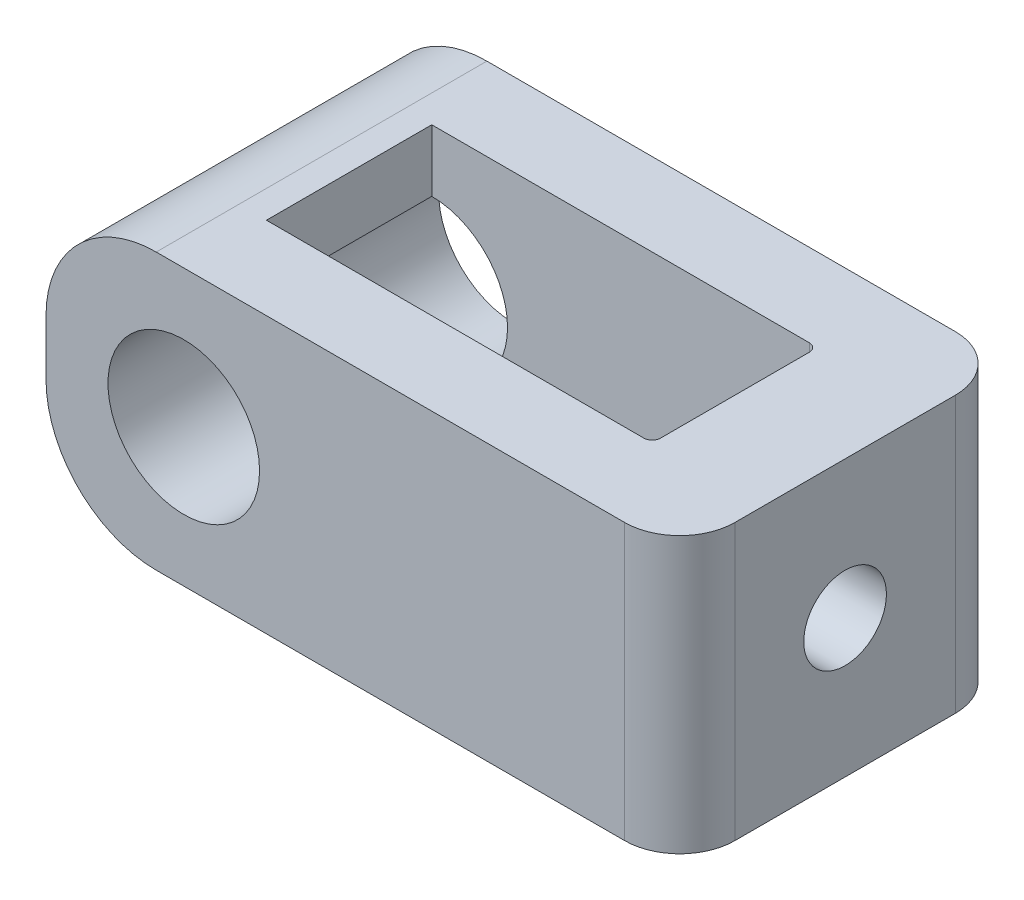
from build123d import *
from build123d.topology import SkipClean

# Parameters (mm, degrees)
EXTRUDE_1_DEPTH     = 10
SKETCH_2_R          = 2.75
CUT_EXTRUDE_1_DEPTH = 16
FILLET_1_R          = 4
SKETCH_3_R          = 1.5
CUT_EXTRUDE_2_DEPTH = 10
FILLET_2_R          = 2
FILLET_3_R          = 0.3
EXTRUDE_4_DEPTH     = 6


with BuildPart() as part:
    # 草图1 → 凸台-拉伸1 (new body)
    with BuildSketch(Plane(origin=(0, 0, 0), x_dir=(1, 0, 0), z_dir=(0, 1, 0))):
        Polygon((0, 3), (-19, 3), (-19, 6), (0, 6), (4, 6), (4, -6), (0, -6), (-19, -6), (-19, -3), (0, -3), align=None)
    extrude(amount=EXTRUDE_1_DEPTH)

    # 草图2 → 切除-拉伸1 (cut)
    with BuildSketch(Plane.XY.offset(6)):
        with Locations((-14, 5)):
            Circle(SKETCH_2_R)
    extrude(amount=-CUT_EXTRUDE_1_DEPTH, mode=Mode.SUBTRACT)

    # 圆角1
    fillet_1_edges = [part.edges().sort_by_distance(p)[0] for p in [
        (-19, 0, -4.5),
        (-19, 10, 4.5),
        (-19, 0, 4.5),
        (-19, 10, -4.5),
    ]]
    fillet(fillet_1_edges, radius=FILLET_1_R)

    # 草图3 → 切除-拉伸2 (cut)
    with BuildSketch(Plane(origin=(4, 0, 0), x_dir=(0, 0, -1), z_dir=(1, 0, 0))):
        with Locations((0, 5)):
            Circle(SKETCH_3_R)
    extrude(amount=-CUT_EXTRUDE_2_DEPTH, mode=Mode.SUBTRACT)

    # 圆角2
    fillet_2_edges = [part.edges().sort_by_distance(p)[0] for p in [
        (4, 5, -6),
        (4, 5, 6),
    ]]
    fillet(fillet_2_edges, radius=FILLET_2_R)

    # 圆角3
    fillet_3_edges = [part.edges().sort_by_distance(p)[0] for p in [
        (0, 5, -3),
        (0, 5, 3),
    ]]
    fillet(fillet_3_edges, radius=FILLET_3_R)

    # 草图9 → 凸台-拉伸4 (add)
    with SkipClean():  # the faces are left unmerged after this step: merging them gives an invalid solid
        with BuildSketch(Plane.XY.offset(-3)):
            with BuildLine():
                ThreePointArc((-15, 10), (-17.828427125, 8.828427125), (-19, 6))
                Line((-19, 6), (-19, 4))
                ThreePointArc((-19, 4), (-17.828427125, 1.171572875), (-15, 0))
                Line((-15, 0), (-14, 0))
                Line((-14, 0), (-14, 2.25))
                ThreePointArc((-14, 2.25), (-16.75, 5), (-14, 7.75))
                Line((-14, 7.75), (-14, 10))
                Line((-14, 10), (-15, 10))
            make_face()
        extrude(amount=EXTRUDE_4_DEPTH)


solid = part.part
